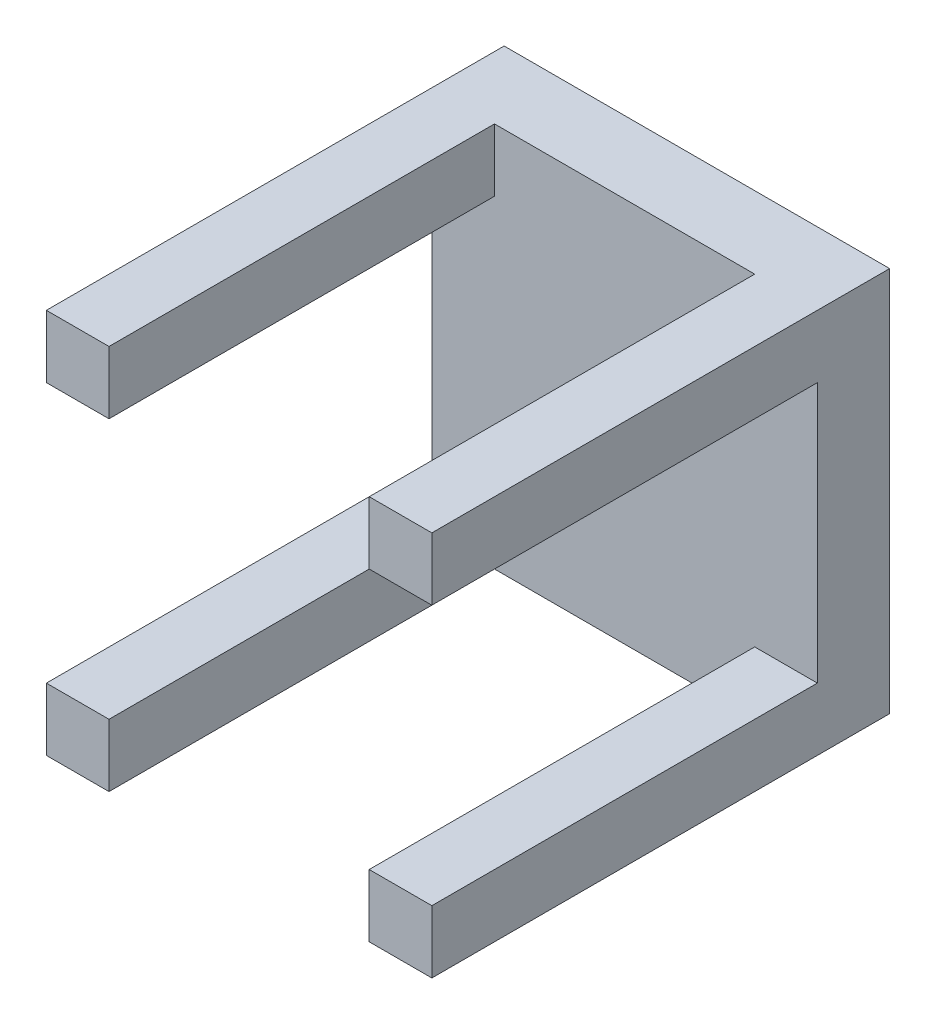
from build123d import *

# Parameters (mm, degrees)
SKETCH_1_W      = 14.849242405
SKETCH_1_H      = 14.849242405
EXTRUDE_6_DEPTH = 15
SKETCH_4_W      = 13
SKETCH_4_H      = 13
EXTRUDE_7_DEPTH = 80


with BuildPart() as part:
    # 草图1 → 凸台-拉伸6 (new body)
    with BuildSketch(Plane.XY):
        with Locations((-32.575378798, 32.575378798)):
            Rectangle(SKETCH_1_W, SKETCH_1_H)
        Polygon((25.150757595, 40), (-25.150757595, 40), (-25.150757595, 25.150757595), (-40, 25.150757595), (-40, -25.150757595), (-25.150757595, -25.150757595), (-25.150757595, -40), (25.150757595, -40), (25.150757595, -25.150757595), (40, -25.150757595), (40, 25.150757595), (25.150757595, 25.150757595), align=None)
        with Locations((32.575378798, 32.575378798)):
            Rectangle(SKETCH_1_W, SKETCH_1_H)
        Polygon((40, -39.62158524), (40, -25.150757595), (25.150757595, -25.150757595), (25.150757595, -40), (39.62158524, -40), (40, -40), align=None)
        Polygon((-25.150757595, -25.150757595), (-40, -25.150757595), (-40, -40), (-25.902864758, -40), (-25.150757595, -40), align=None)
    extrude(amount=EXTRUDE_6_DEPTH)

    # 草图4 → 凸台-拉伸7 (add)
    with BuildSketch(Plane.XY.offset(15)):
        with Locations((-33.5, 33.5)):
            Rectangle(SKETCH_4_W, SKETCH_4_H)
        with Locations((33.5, 33.5)):
            Rectangle(SKETCH_4_W, SKETCH_4_H)
        with Locations((-33.5, -33.5)):
            Rectangle(SKETCH_4_W, SKETCH_4_H)
        with Locations((33.5, -33.5)):
            Rectangle(SKETCH_4_W, SKETCH_4_H)
    extrude(amount=EXTRUDE_7_DEPTH)


solid = part.part
